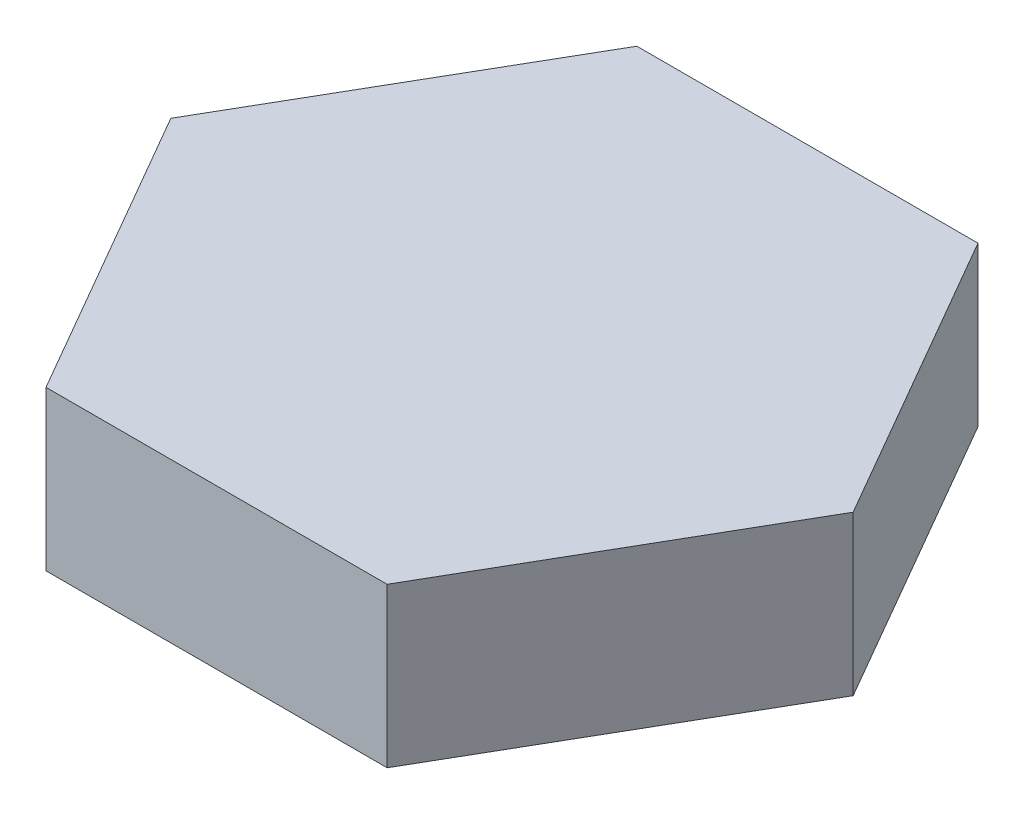
from build123d import *

# Parameters (mm, degrees)
BOSS_EXTRUDE1_DEPTH = 44.724226537


with BuildPart() as part:
    # Sketch1 → Boss-Extrude1 (new body)
    with BuildSketch(Plane(origin=(0, 0, 0), x_dir=(1, 0, 0), z_dir=(0, 1, 0))):
        Polygon((-48, 83.138438763), (48, 83.138438763), (96, 0), (48, -83.138438763), (-48, -83.138438763), (-96, 0), align=None)
    extrude(amount=BOSS_EXTRUDE1_DEPTH)


solid = part.part
